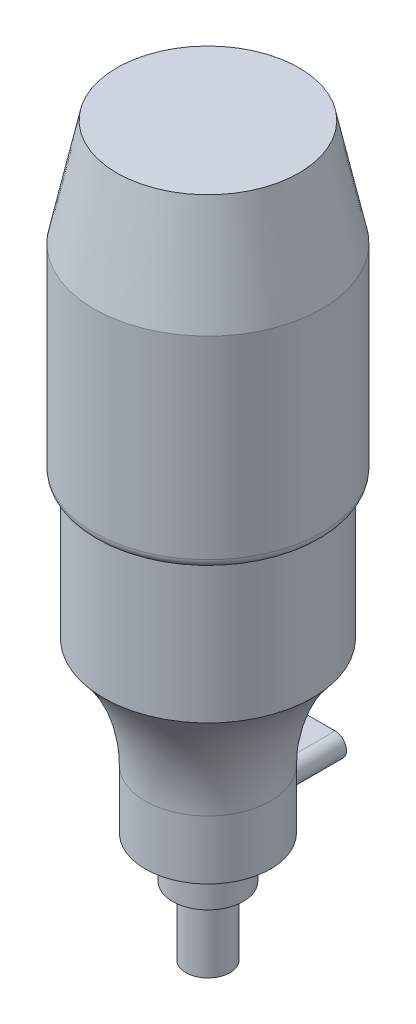
from build123d import *

# Parameters (mm, degrees)
ESQUISSE3_W             = 38
ESQUISSE3_H             = 17.5
ENL_V_MAT_EXTRU_1_DEPTH = 10
BOSS_EXTRU_1_REACH      = 188.017
BOSS_EXTRU_1_END_RADIUS = 16.5


with BuildPart() as part:
    # Esquisse1 → Révol.-Mince1 (revolve)
    with BuildSketch(Plane.XY, mode=Mode.PRIVATE) as r_vol_mince1_sk:
        with BuildLine():
            Line((0, 0), (0, -18))
            Line((0, -18), (5.8, -18))
            Line((5.8, -18), (5.8, 0))
            Line((5.8, 0), (9.3, 0))
            Line((9.3, 0), (9.3, 11))
            Line((9.3, 11), (16.5, 11))
            Line((16.5, 11), (16.5, 26.5))
            ThreePointArc((16.5, 26.5), (19.342380895, 42.008062419), (27.5, 55.5))
            Line((27.5, 55.5), (27.5, 92))
            ThreePointArc((27.5, 92), (29.267766953, 92.732233047), (30, 94.5))
            Line((30, 94.5), (30, 145.5))
            Line((30, 145.5), (24, 173.5))
            Line((24, 173.5), (0, 173.5))
            Line((0, 173.5), (0, 172.5))
            Line((0, 172.5), (23.19158421, 172.5))
            Line((23.19158421, 172.5), (29, 145.394059646))
            Line((29, 145.394059646), (29, 94.5))
            ThreePointArc((29, 94.5), (28.112372436, 93.130693606), (26.5, 93.381966011))
            Line((26.5, 93.381966011), (26.5, 55.876861643))
            ThreePointArc((26.5, 55.876861643), (18.340175363, 42.184387141), (15.5, 26.5))
            Line((15.5, 26.5), (15.5, 12))
            Line((15.5, 12), (8.3, 12))
            Line((8.3, 12), (8.3, 1))
            Line((8.3, 1), (4.8, 1))
            Line((4.8, 1), (4.8, -17))
            Line((4.8, -17), (1, -17))
            Line((1, -17), (1, 0))
            Line((1, 0), (0, 0))
        make_face()
    revolve(r_vol_mince1_sk.sketch.rotate(Axis((0, 182.175, 0), (0, -1, 0)), 90), axis=Axis((0, 182.175, 0), (0, -1, 0)))

    # Esquisse3 → Enlèv. mat.-Extru.1 (cut)
    with BuildSketch(Plane(origin=(0, 0, -30), x_dir=(-1, 0, 0), z_dir=(0, 0, -1))):
        with Locations((0, 126.75)):
            Rectangle(ESQUISSE3_W, ESQUISSE3_H)
    extrude(amount=-ENL_V_MAT_EXTRU_1_DEPTH, mode=Mode.SUBTRACT)

    # Boss.-Extru.1: up to this cylinder (the profile starts outside it)
    boss_extru_1_end = Plane(origin=(0, 18, 0), z_dir=(0, 1, 0)) * Cylinder(BOSS_EXTRU_1_END_RADIUS, 410.034, mode=Mode.PRIVATE)
    # Esquisse4 → Boss.-Extru.1 (add, up to the surface)
    with BuildSketch(Plane(origin=(0, 0, -30), x_dir=(-1, 0, 0), z_dir=(0, 0, -1)), mode=Mode.PRIVATE) as boss_extru_1_sk1:
        with BuildLine():
            Line((-3.5, 21), (3.5, 21))
            ThreePointArc((3.5, 21), (6.5, 18), (3.5, 15))
            Line((3.5, 15), (-3.5, 15))
            ThreePointArc((-3.5, 15), (-6.5, 18), (-3.5, 21))
        make_face()
    boss_extru_1_tool1 = extrude(boss_extru_1_sk1.sketch, amount=-BOSS_EXTRU_1_REACH, mode=Mode.PRIVATE) - boss_extru_1_end
    add(boss_extru_1_tool1.solids().sort_by_distance((0, 18, -30))[0])


solid = part.part
